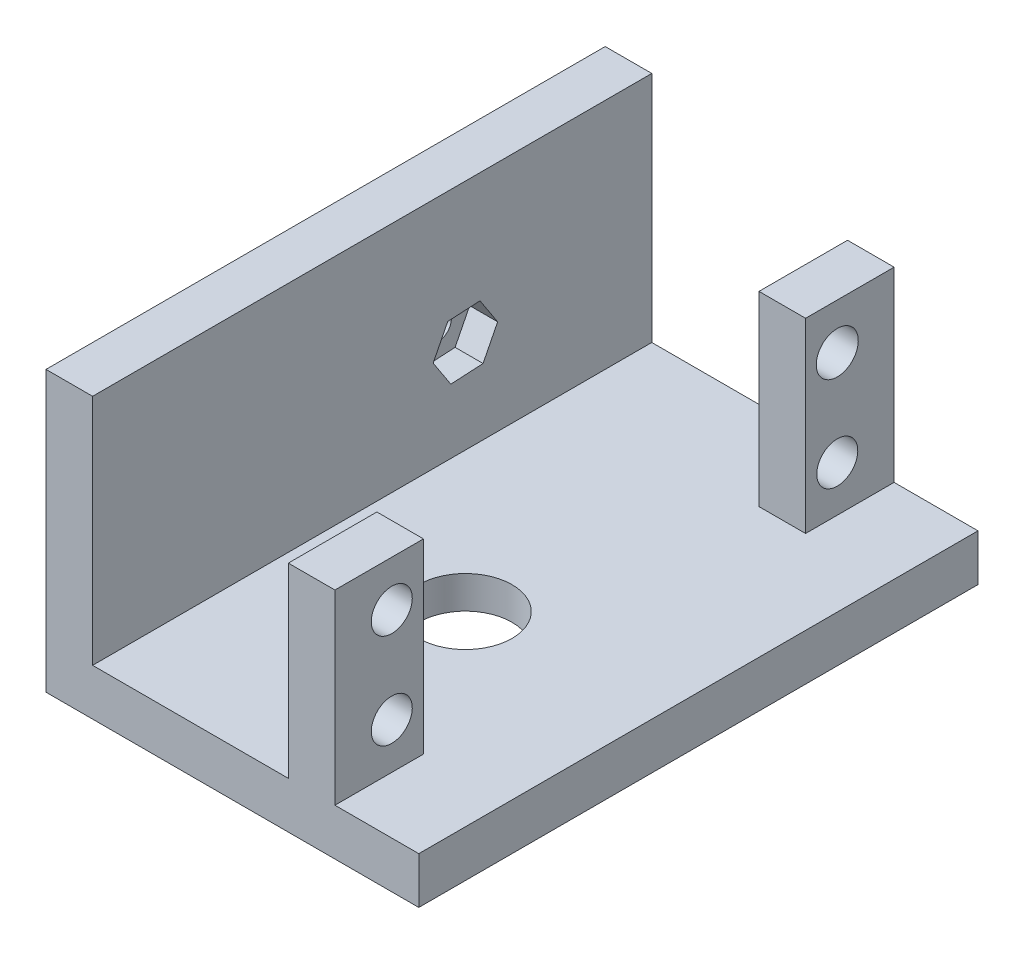
from build123d import *

# Parameters (mm, degrees)
SALIENTE_EXTRUIR1_DEPTH = 60
CROQUIS2_W              = 5
CROQUIS2_H              = 41
CORTAR_EXTRUIR1_DEPTH   = 20
CROQUIS4_R              = 10.5
CORTAR_EXTRUIR3_DEPTH   = 1.5
CROQUIS5_R              = 5
CORTAR_EXTRUIR4_DEPTH   = 51.5
CROQUIS7_R              = 2.2
CROQUIS7_R_2            = 2.253524607
CORTAR_EXTRUIR5_DEPTH   = 10
CROQUIS8_R              = 1.5
CORTAR_EXTRUIR6_DEPTH   = 10
CORTAR_EXTRUIR7_DEPTH   = 3


with BuildPart() as part:
    # Croquis1 → Saliente-Extruir1 (new body)
    with BuildSketch(Plane.XY):
        Polygon((0, 0), (40, 0), (40, 5), (31, 5), (31, 25), (26, 25), (26, 5), (5, 5), (5, 30), (0, 30), align=None)
    extrude(amount=SALIENTE_EXTRUIR1_DEPTH)

    # Croquis2 → Cortar-Extruir1 (cut)
    with BuildSketch(Plane(origin=(0, 25, 0), x_dir=(1, 0, 0), z_dir=(0, 1, 0))):
        with Locations((28.5, -30)):
            Rectangle(CROQUIS2_W, CROQUIS2_H)
    extrude(amount=-CORTAR_EXTRUIR1_DEPTH, mode=Mode.SUBTRACT)

    # Croquis4 → Cortar-Extruir3 (cut)
    with BuildSketch(Plane.XZ):
        with Locations(Location((20, 35, 0), (0, 0, 270))):
            Circle(CROQUIS4_R)
    extrude(amount=-CORTAR_EXTRUIR3_DEPTH, mode=Mode.SUBTRACT)

    # Croquis5 → Cortar-Extruir4 (cut)
    with BuildSketch(Plane.XZ.offset(-1.5)):
        with Locations(Location((20, 35, 0), (0, 0, 270))):
            Circle(CROQUIS5_R)
    extrude(amount=-CORTAR_EXTRUIR4_DEPTH, mode=Mode.SUBTRACT)

    # Croquis7 → Cortar-Extruir5 (cut)
    with BuildSketch(Plane(origin=(31, 0, 0), x_dir=(0, 0, -1), z_dir=(1, 0, 0))):
        with Locations(Location((-53.9, 20.1, 0), (0, 0, 90))):
            Circle(CROQUIS7_R)
        with Locations(Location((-53.9, 9.9, 0), (0, 0, 90))):
            Circle(CROQUIS7_R)
        with Locations(Location((-6.1, 9.9, 0), (0, 0, 90))):
            Circle(CROQUIS7_R)
        with Locations(Location((-6.1, 20.1, 0), (0, 0, 90))):
            Circle(CROQUIS7_R_2)
    extrude(amount=-CORTAR_EXTRUIR5_DEPTH, mode=Mode.SUBTRACT)

    # Croquis8 → Cortar-Extruir6 (cut)
    with BuildSketch(Plane.ZY):
        with Locations(Location((20, 15, 0), (0, 0, 270))):
            Circle(CROQUIS8_R)
    extrude(amount=-CORTAR_EXTRUIR6_DEPTH, mode=Mode.SUBTRACT)

    # Croquis9 → Cortar-Extruir7 (cut)
    with BuildSketch(Plane(origin=(5, 0, 0), x_dir=(0, 0, -1), z_dir=(1, 0, 0))):
        Polygon((-18.435990885, 18.090934404), (-21.894823157, 17.899938827), (-23.458832273, 14.809004424), (-21.564009115, 11.909065596), (-18.105176843, 12.100061173), (-16.541167727, 15.190995576), align=None)
    extrude(amount=-CORTAR_EXTRUIR7_DEPTH, mode=Mode.SUBTRACT)


solid = part.part
